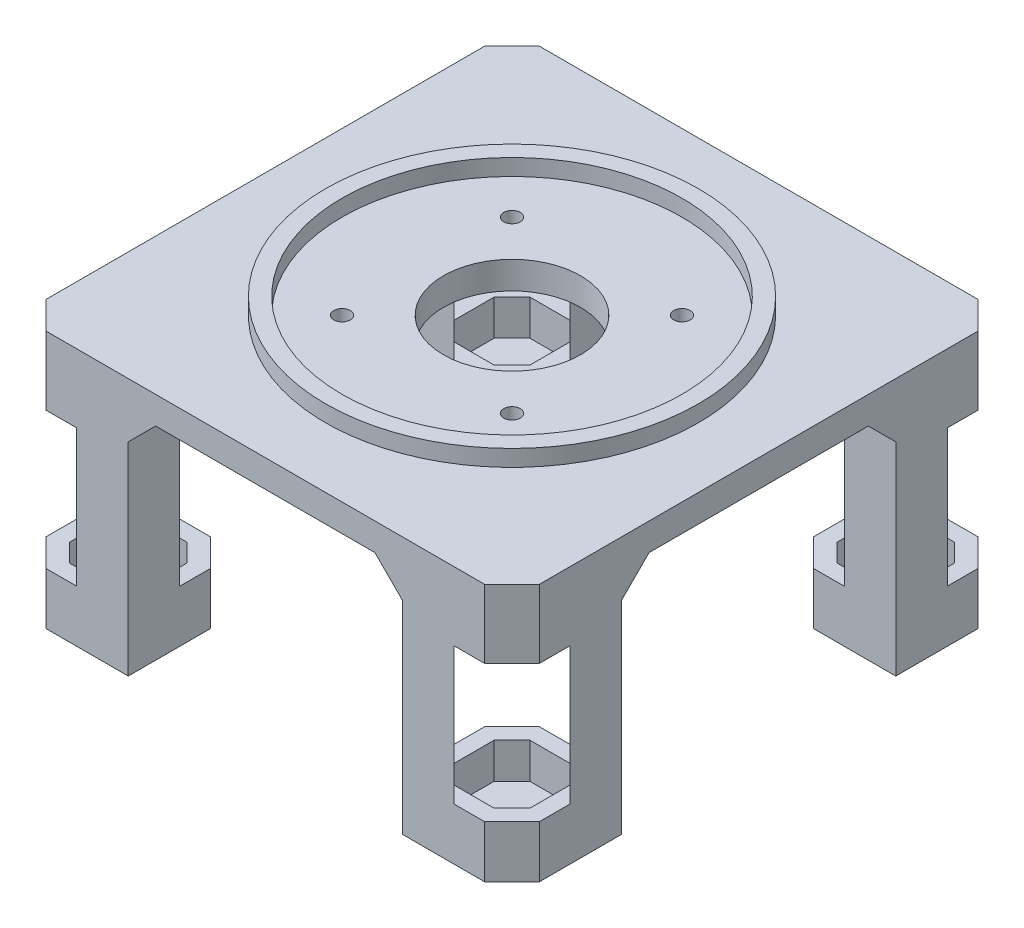
from build123d import *

# Parameters (mm, degrees)
SKETCH_1_W               = 90
SKETCH_1_H               = 90.00000171
SKETCH_1_R               = 12.5
SKETCH_1_R_2             = 1.5
EXTRUDE_1_DEPTH          = 5
CHAMFER_1_SIZE           = 5
SKETCH_2_R               = 34
SKETCH_2_R_2             = 31
EXTRUDE_2_DEPTH          = 3
EXTRUDE_3_DEPTH          = 42
CHAMFER_2_SIZE           = 5
SKETCH_4_W               = 15
SKETCH_4_H               = 25
CUT_EXTRUDE_1_DEPTH      = 157
PATTERN_CIRCULAR_1_COUNT = 2
PATTERN_CIRCULAR_1_ANGLE = 90
SKETCH_5_R               = 1.5
EXTRUDE_4_DEPTH          = 3


with BuildPart() as part:
    # 草图1 → 凸台-拉伸1 (new body)
    with BuildSketch(Plane(origin=(0, 0, 0), x_dir=(1, 0, 0), z_dir=(0, 1, 0))):
        Rectangle(SKETCH_1_W, SKETCH_1_H)
        with Locations(Location((0, 0, 0), (0, 0, 270))):
            Circle(SKETCH_1_R, mode=Mode.SUBTRACT)
        with Locations(Location((15.5, 15.500000294, 0), (0, 0, 270))):
            Circle(SKETCH_1_R_2, mode=Mode.SUBTRACT)
        with Locations(Location((-15.500000589, -15.499999706, 0), (0, 0, 90))):
            Circle(SKETCH_1_R_2, mode=Mode.SUBTRACT)
        with Locations(Location((15.500000589, -15.499999706, 0), (0, 0, 270))):
            Circle(SKETCH_1_R_2, mode=Mode.SUBTRACT)
        with Locations(Location((-15.5, 15.500000294, 0), (0, 0, 90))):
            Circle(SKETCH_1_R_2, mode=Mode.SUBTRACT)
    extrude(amount=EXTRUDE_1_DEPTH)

    # 倒角1
    chamfer_1_edges = [part.edges().sort_by_distance(p)[0] for p in [
        (45, 2.5, 45.000000855),
        (-45, 2.5, 45.000000855),
        (-45, 2.5, -45.000000855),
        (45, 2.5, -45.000000855),
    ]]
    chamfer(chamfer_1_edges, length=CHAMFER_1_SIZE)

    # 草图2 → 凸台-拉伸2 (add)
    with BuildSketch(Plane(origin=(0, 5, 0), x_dir=(1, 0, 0), z_dir=(0, 1, 0))):
        with Locations(Location((0, 0, 0), (0, 0, 90))):
            Circle(SKETCH_2_R)
        with Locations(Location((0, 0, 0), (0, 0, 270))):
            Circle(SKETCH_2_R_2, mode=Mode.SUBTRACT)
    extrude(amount=EXTRUDE_2_DEPTH)

    # 草图3 → 凸台-拉伸3 (add)
    # profile 1 of 4: a face of its own
    with BuildSketch(Plane.XZ):
        Polygon((25, 45.000000855), (40, 45.000000855), (45, 40.000000855), (45, 25.000000855), (30, 25.000000855), (25, 30.000000855), align=None)
        Polygon((28, 31.242641542), (31.242640687, 28.000000855), (42, 28.000000855), (42, 38.757360167), (38.757359313, 42.000000855), (28, 42.000000855), align=None, mode=Mode.SUBTRACT)
    # profile 2 of 4: a face of its own
    with BuildSketch(Plane.XZ):
        Polygon((25, -45.000000855), (25, -30.000000855), (30, -25.000000855), (45, -25.000000855), (45, -40.000000855), (40, -45.000000855), align=None)
        Polygon((28, -42.000000855), (28, -31.242641542), (31.242640687, -28.000000855), (42, -28.000000855), (42, -38.757360167), (38.757359313, -42.000000855), align=None, mode=Mode.SUBTRACT)
    # profile 3 of 4: a face of its own
    with BuildSketch(Plane.XZ):
        Polygon((-25, -45.000000855), (-40, -45.000000855), (-45, -40.000000855), (-45, -25.000000855), (-30, -25.000000855), (-25, -30.000000855), align=None)
        Polygon((-28, -42.000000855), (-38.757359313, -42.000000855), (-42, -38.757360167), (-42, -28.000000855), (-31.242640687, -28.000000855), (-28, -31.242641542), align=None, mode=Mode.SUBTRACT)
    # profile 4 of 4: a face of its own
    with BuildSketch(Plane.XZ):
        Polygon((-25, 45.000000855), (-25, 30.000000855), (-30, 25.000000855), (-45, 25.000000855), (-45, 40.000000855), (-40, 45.000000855), align=None)
        Polygon((-28, 42.000000855), (-28, 31.242641542), (-31.242640687, 28.000000855), (-42, 28.000000855), (-42, 38.757360167), (-38.757359313, 42.000000855), align=None, mode=Mode.SUBTRACT)
    extrude(amount=EXTRUDE_3_DEPTH)

    # 倒角2
    chamfer_2_edges = [part.edges().sort_by_distance(p)[0] for p in [
        (37.5, 0, -25.000000855),
        (25, 0, -37.500000855),
        (-25, 0, -37.500000855),
        (-37.5, 0, -25.000000855),
        (-37.5, 0, 25.000000855),
        (-25, 0, 37.500000855),
        (25, 0, 37.500000855),
        (37.5, 0, 25.000000855),
    ]]
    chamfer(chamfer_2_edges, length=CHAMFER_2_SIZE)

    # 草图4 → 切除-拉伸1 (cut)
    with BuildSketch(Plane(origin=(-42.500000427, 0, 42.500000427), x_dir=(0.7071067811865456, 0, 0.7071067811865495), z_dir=(-0.7071067811865495, 0, 0.7071067811865456))):
        with Locations((0, -20)):
            Rectangle(SKETCH_4_W, SKETCH_4_H)
    cut_extrude_1 = extrude(amount=-CUT_EXTRUDE_1_DEPTH, mode=Mode.SUBTRACT)

    # 阵列(圆周)1: 切除-拉伸1 ×2 about axis
    pattern_circular_1_axis = Axis((0, 8, 0), (0, -1, 0))
    for i in range(1, PATTERN_CIRCULAR_1_COUNT):
        add(cut_extrude_1.rotate(pattern_circular_1_axis, i * PATTERN_CIRCULAR_1_ANGLE / (PATTERN_CIRCULAR_1_COUNT - 1)), mode=Mode.SUBTRACT)

    # 草图5 → 凸台-拉伸4 (add)
    # profile 1 of 4: a face of its own
    with BuildSketch(Plane.XZ.offset(42)):
        Polygon((-25, -45.000000855), (-25, -30.000000855), (-30, -25.000000855), (-45, -25.000000855), (-45, -40.000000855), (-40, -45.000000855), align=None)
        with Locations(Location((-35, -35.000000855, 0), (0, 0, 90))):
            Circle(SKETCH_5_R, mode=Mode.SUBTRACT)
    # profile 2 of 4: a face of its own
    with BuildSketch(Plane.XZ.offset(42)):
        Polygon((40, -45.000000855), (45, -40.000000855), (45, -25.000000855), (30, -25.000000855), (25, -30.000000855), (25, -45.000000855), align=None)
        with Locations(Location((35, -35.000000855, 0), (0, 0, 270))):
            Circle(SKETCH_5_R, mode=Mode.SUBTRACT)
    # profile 3 of 4: a face of its own
    with BuildSketch(Plane.XZ.offset(42)):
        Polygon((25, 45.000000855), (25, 30.000000855), (30, 25.000000855), (45, 25.000000855), (45, 40.000000855), (40, 45.000000855), align=None)
        with Locations(Location((35, 35.000000855, 0), (0, 0, 90))):
            Circle(SKETCH_5_R, mode=Mode.SUBTRACT)
    # profile 4 of 4: a face of its own
    with BuildSketch(Plane.XZ.offset(42)):
        Polygon((-40, 45.000000855), (-45, 40.000000855), (-45, 25.000000855), (-30, 25.000000855), (-25, 30.000000855), (-25, 45.000000855), align=None)
        with Locations(Location((-35, 35.000000855, 0), (0, 0, 270))):
            Circle(SKETCH_5_R, mode=Mode.SUBTRACT)
    extrude(amount=-EXTRUDE_4_DEPTH)


solid = part.part
